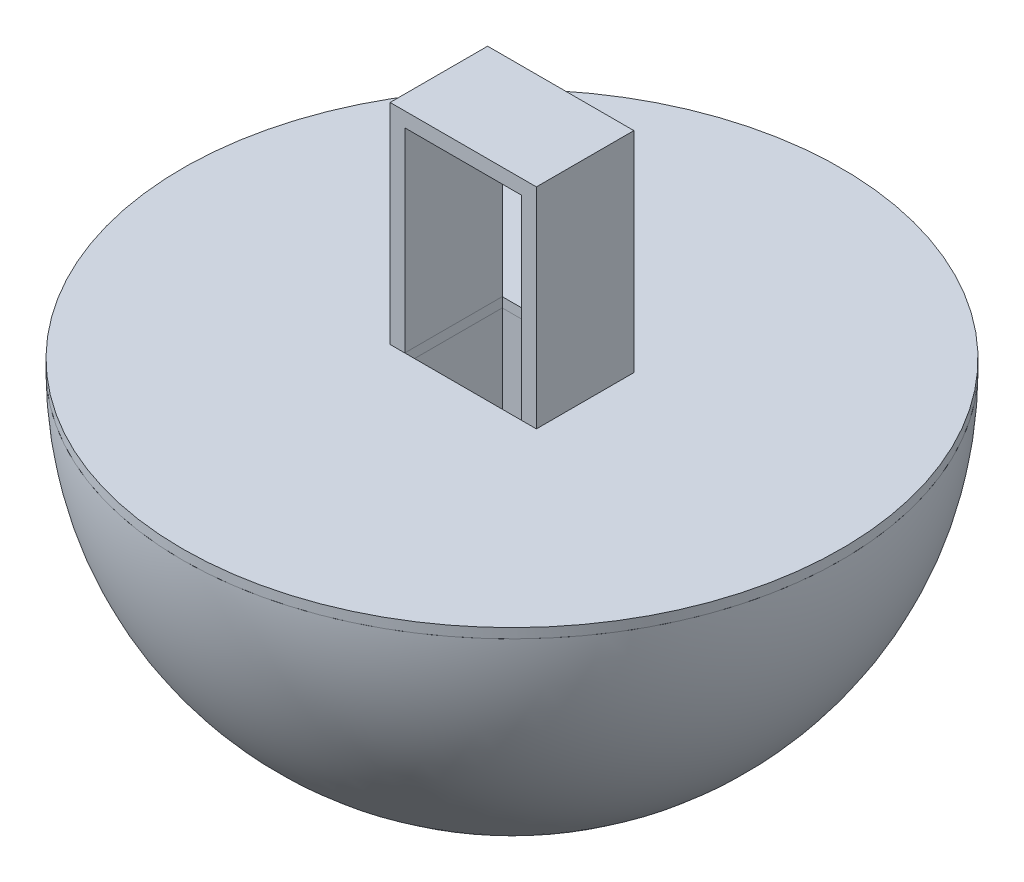
from build123d import *

# Parameters (mm, degrees)
SHELL8_T                 = -1
BOSS_EXTRUDE2_REACH      = 60.543
BOSS_EXTRUDE2_END_RADIUS = 32.8
SKETCH5_W                = 14
SKETCH5_H                = 12
SKETCH5_W_2              = 12
SKETCH5_H_2              = 10
BOSS_EXTRUDE3_REACH      = 78.543
BOSS_EXTRUDE3_END_RADIUS = 32.8
BOSS_EXTRUDE3_START      = -18
SKETCH6_W                = 12
SKETCH6_H                = 10
SKETCH6_R                = 4
SKETCH7_R                = 1
CUT_EXTRUDE3_DEPTH       = 52.077196477
SKETCH8_R                = 33.8
SKETCH8_W                = 12
SKETCH8_H                = 10
BOSS_EXTRUDE4_DEPTH      = 1
SKETCH10_W               = 30
SKETCH10_H               = 30
CUT_EXTRUDE4_DEPTH       = 59.402314747
SKETCH11_W               = 1.5
SKETCH11_H               = 10
BOSS_EXTRUDE5_DEPTH      = 20
BOSS_EXTRUDE5_2_DEPTH    = 20
SKETCH12_W               = 15
SKETCH12_H               = 10
BOSS_EXTRUDE6_DEPTH      = 1.5


with BuildPart() as part:
    # Sketch3 → Revolve1 (revolve)
    with BuildSketch(Plane(origin=(0, 0, 0), x_dir=(0, 0, -1), z_dir=(1, 0, 0))):
        with BuildLine():
            Line((0, 33.8), (-33.8, 33.8))
            ThreePointArc((-33.8, 33.8), (-23.900209204, 9.899790796), (0, 0))
            Line((0, 0), (0, 33.8))
        make_face()
    revolve(axis=Axis((0, 0, 0), (0, 1, 0)))

    # Shell8
    shell8_openings = [part.faces().sort_by_distance(p)[0] for p in [
        (0, 33.8, 0),
    ]]
    offset(amount=SHELL8_T, openings=shell8_openings, kind=Kind.INTERSECTION)

    # Boss-Extrude2: up to this sphere (the profile starts inside it)
    boss_extrude2_end = Location((0, 33.8, 0)) * Sphere(BOSS_EXTRUDE2_END_RADIUS, mode=Mode.PRIVATE)
    # Sketch5 → Boss-Extrude2 (add, up to the surface)
    with BuildSketch(Plane(origin=(0, 33.8, 0), x_dir=(1, 0, 0), z_dir=(0, 1, 0)), mode=Mode.PRIVATE) as boss_extrude2_sk1:
        Rectangle(SKETCH5_W, SKETCH5_H)
        Rectangle(SKETCH5_W_2, SKETCH5_H_2, mode=Mode.SUBTRACT)
    boss_extrude2_tool1 = extrude(boss_extrude2_sk1.sketch, amount=-BOSS_EXTRUDE2_REACH, mode=Mode.PRIVATE) & boss_extrude2_end
    add(boss_extrude2_tool1.solids().sort_by_distance((-6.815609, 33.8, 0))[0])

    # Boss-Extrude3: up to this sphere (the profile starts inside it)
    boss_extrude3_end = Location((0, 33.8, 0)) * Sphere(BOSS_EXTRUDE3_END_RADIUS, mode=Mode.PRIVATE)
    # Sketch6 → Boss-Extrude3 (add, up to the surface)
    with BuildSketch(Plane(origin=(0, 33.8, 0), x_dir=(1, 0, 0), z_dir=(0, 1, 0)).offset(BOSS_EXTRUDE3_START), mode=Mode.PRIVATE) as boss_extrude3_sk1:
        Rectangle(SKETCH6_W, SKETCH6_H)
        with Locations(Location((0, 0, 0), (0, 0, 270))):
            Circle(SKETCH6_R, mode=Mode.SUBTRACT)
    boss_extrude3_tool1 = extrude(boss_extrude3_sk1.sketch, amount=-BOSS_EXTRUDE3_REACH, mode=Mode.PRIVATE) & boss_extrude3_end
    add(boss_extrude3_tool1.solids().sort_by_distance((0, 15.8, 4.843795))[0])

    # Sketch7 → Cut-Extrude3 (cut, through all)
    with BuildSketch(Plane(origin=(0, 15.8, 0), x_dir=(1, 0, 0), z_dir=(0, 1, 0))):
        with Locations(Location((0, 0, 0), (0, 0, 270))):
            Circle(SKETCH7_R)
    extrude(amount=-CUT_EXTRUDE3_DEPTH, mode=Mode.SUBTRACT)

    # Sketch10 → Cut-Extrude4 (cut, through all)
    with BuildSketch(Plane(origin=(0, 1.244816081, 0), x_dir=(1, 0, 0), z_dir=(0, 1, 0))):
        Rectangle(SKETCH10_W, SKETCH10_H)
    extrude(amount=-CUT_EXTRUDE4_DEPTH, mode=Mode.SUBTRACT)


with BuildPart() as body_2:
    # Sketch8 → Boss-Extrude4 (new body)
    with BuildSketch(Plane(origin=(0, 33.8, 0), x_dir=(1, 0, 0), z_dir=(0, 1, 0))):
        with Locations(Location((0, 0, 0), (0, 0, 270))):
            Circle(SKETCH8_R)
        Rectangle(SKETCH8_W, SKETCH8_H, mode=Mode.SUBTRACT)
    extrude(amount=BOSS_EXTRUDE4_DEPTH)


with BuildPart() as body_3:
    # Sketch11 → Boss-Extrude5 (new body)
    with BuildSketch(Plane(origin=(0, 34.8, 0), x_dir=(1, 0, 0), z_dir=(0, 1, 0))):
        with Locations((-6.75, 0)):
            Rectangle(SKETCH11_W, SKETCH11_H)
    extrude(amount=BOSS_EXTRUDE5_DEPTH)



with BuildPart() as body_4:
    # Sketch11 → Boss-Extrude5 2 (new body)
    with BuildSketch(Plane(origin=(0, 34.8, 0), x_dir=(1, 0, 0), z_dir=(0, 1, 0))):
        with Locations((6.75, 0)):
            Rectangle(SKETCH11_W, SKETCH11_H)
    extrude(amount=BOSS_EXTRUDE5_2_DEPTH)


with BuildPart() as body_3_1:
    add(body_3.part)

    add(body_4.part)  # Boss-Extrude6 merges body 4
    # Sketch12 → Boss-Extrude6 (add)
    with BuildSketch(Plane(origin=(0, 54.8, 0), x_dir=(1, 0, 0), z_dir=(0, 1, 0))):
        Rectangle(SKETCH12_W, SKETCH12_H)
    extrude(amount=BOSS_EXTRUDE6_DEPTH)


solid = Compound([part.part, body_2.part, body_3_1.part])
